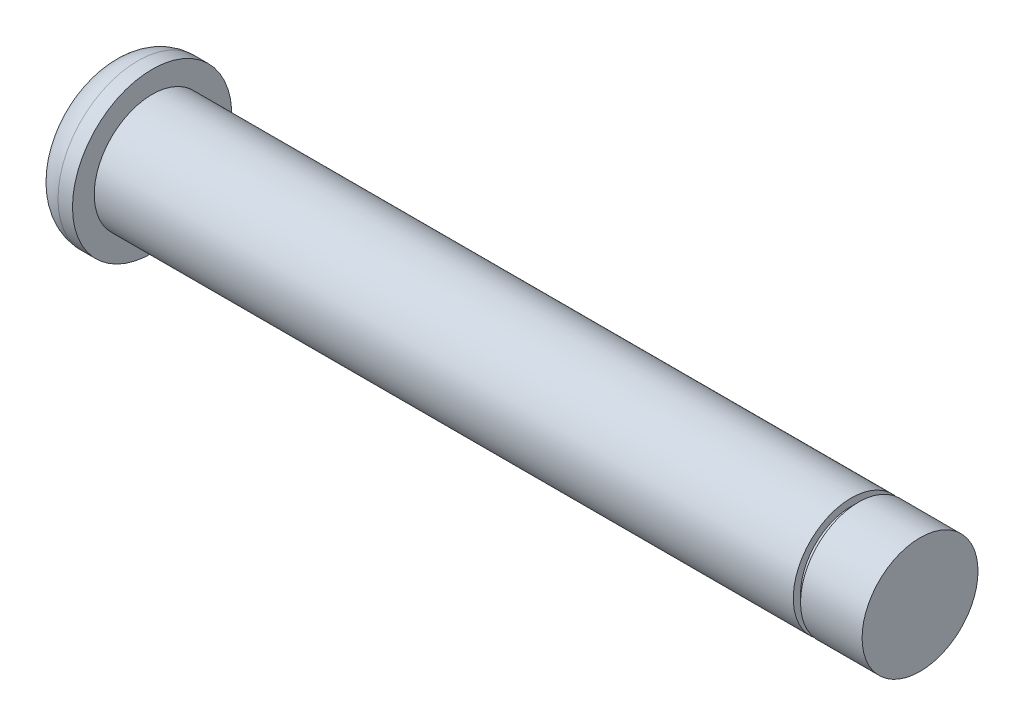
from build123d import *

# Parameters (mm, degrees)
SKETCH1_R           = 4
BOSS_EXTRUDE1_DEPTH = 53
SKETCH2_R           = 5.5
BOSS_EXTRUDE2_DEPTH = 3
FILLET1_R           = 2
SKETCH4_W           = 0.5
SKETCH4_H           = 1


with BuildPart() as part:
    # Sketch1 → Boss-Extrude1 (new body)
    with BuildSketch(Plane(origin=(0, 0, 0), x_dir=(0, 0, -1), z_dir=(1, 0, 0))):
        Circle(SKETCH1_R)
    extrude(amount=BOSS_EXTRUDE1_DEPTH)

    # Sketch2 → Boss-Extrude2 (add)
    with BuildSketch(Plane.ZY):
        Circle(SKETCH2_R)
    extrude(amount=BOSS_EXTRUDE2_DEPTH)

    # Fillet1
    fillet1_edges = [part.edges().sort_by_distance(p)[0] for p in [
        (-3, 0, -5.5),
    ]]
    fillet(fillet1_edges, radius=FILLET1_R)

    # Sketch4 → Cut-Revolve1 (revolve, cut)
    with BuildSketch(Plane.XY, mode=Mode.PRIVATE) as cut_revolve1_sk:
        with Locations((48.5, 4)):
            Rectangle(SKETCH4_W, SKETCH4_H)
    revolve(cut_revolve1_sk.sketch.rotate(Axis((0, 0, 0), (1, 0, 0)), 90), axis=Axis((0, 0, 0), (1, 0, 0)), mode=Mode.SUBTRACT)


solid = part.part
